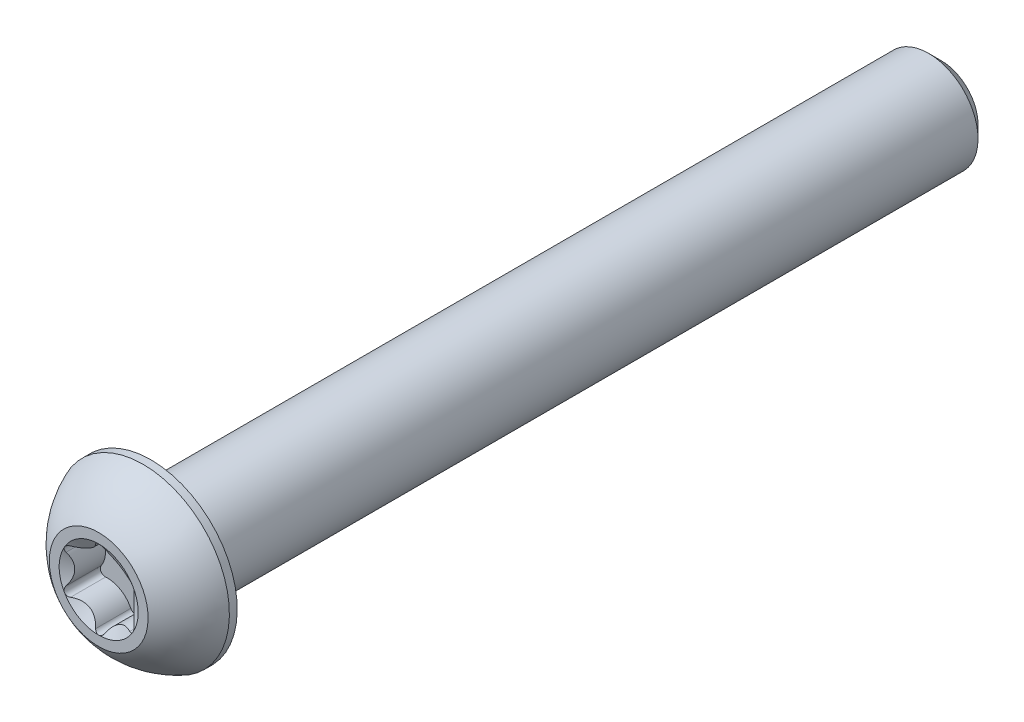
from build123d import *

# Parameters (mm, degrees)
CUT_EXTRUDE1_DEPTH = 2.34696
CIRPATTERN1_COUNT  = 6


with BuildPart() as part:
    # Sketch3 → Revolve1 (revolve)
    with BuildSketch(Plane(origin=(0, 0, 0), x_dir=(0, 0, -1), z_dir=(1, 0, 0))):
        with BuildLine():
            Line((2.84988, 5.5499), (3.3528, 5.5499))
            Line((3.3528, 5.5499), (3.3528, 3.175))
            Line((3.3528, 3.175), (53.337781533, 3.175))
            Line((53.337781533, 3.175), (54.1528, 2.359981533))
            Line((54.1528, 2.359981533), (54.1528, 0))
            Line((54.1528, 0), (0, 0))
            Line((0, 0), (0, 3.175))
            ThreePointArc((0, 3.175), (1.235921075, 4.58927271), (2.84988, 5.5499))
        make_face()
    revolve(axis=Axis((0, 0, -54.1528), (0, 0, 1)))

    # Sketch4 → Cut-Extrude1 (cut)
    with BuildSketch(Plane.XY):
        with BuildLine():
            Line((0, 0), (-2.199704526, -1.27))
            ThreePointArc((-2.199704526, -1.27), (-2.242070202, -1.100823133), (-2.188690187, -0.934792301))
            ThreePointArc((-2.188690187, -0.934792301), (-1.905, 0), (-2.188690187, 0.934792301))
            ThreePointArc((-2.188690187, 0.934792301), (-2.242070202, 1.100823133), (-2.199704526, 1.27))
            Line((-2.199704526, 1.27), (0, 0))
        make_face()
    cut_extrude1 = extrude(amount=-CUT_EXTRUDE1_DEPTH, mode=Mode.SUBTRACT)

    # CirPattern1: Cut-Extrude1 ×6 about axis
    cirpattern1_axis = Axis((0, 0, -54.1528), (0, 0, 1))
    for i in range(1, CIRPATTERN1_COUNT):
        add(cut_extrude1.rotate(cirpattern1_axis, i * 360 / CIRPATTERN1_COUNT), mode=Mode.SUBTRACT)

    # Cut-Extrude2 cone 1 section (through the dimple's axis) → Cut-Extrude2 (revolve, cut)
    with BuildSketch(Plane(origin=(0, 0, 0), x_dir=(0, -1, 0), z_dir=(1, 0, 0))):
        Polygon((0, 0), (2.54, 0), (0, 1.466469684), align=None)
    revolve(axis=Axis((0, 0, 0), (0, 0, -1)), mode=Mode.SUBTRACT)


solid = part.part
